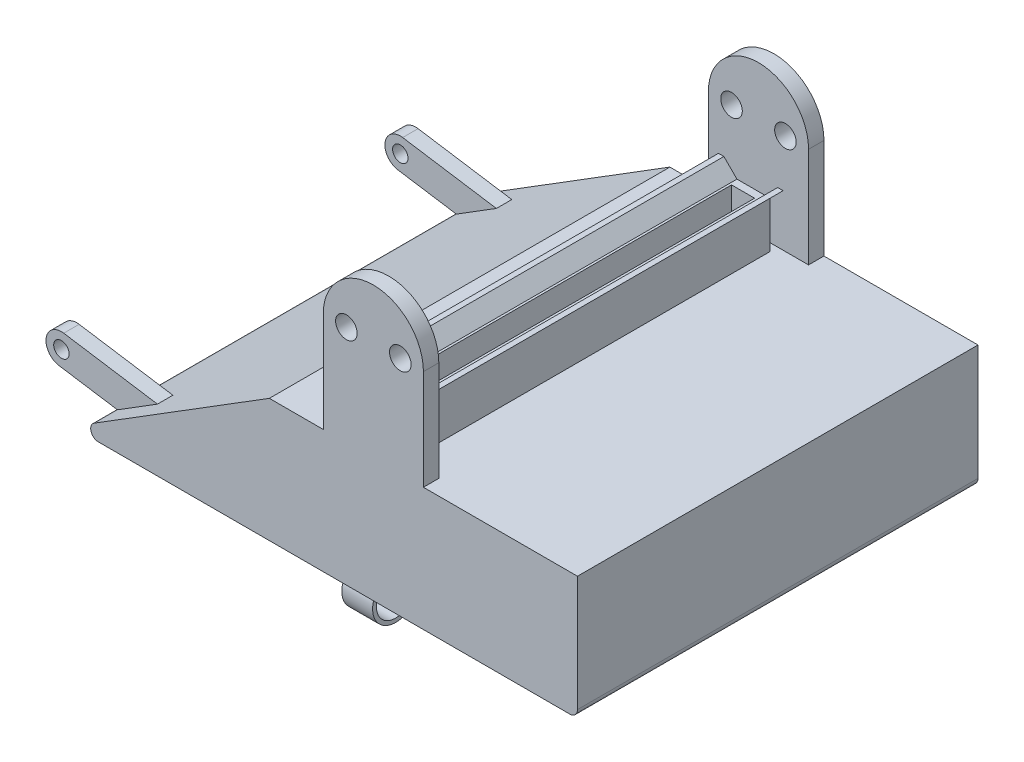
from build123d import *

# Parameters (mm, degrees)
SKETCH5_W            = 200
SKETCH5_H            = 250
SKETCH5_W_2          = 15
SKETCH5_H_2          = 220
BOSS_EXTRUDE7_DEPTH  = 10
BOSS_EXTRUDE13_DEPTH = 250
BOSS_EXTRUDE14_DEPTH = 5
SKETCH8_W            = 25
SKETCH8_H            = 230
SKETCH8_W_2          = 15
SKETCH8_H_2          = 220
BOSS_EXTRUDE15_DEPTH = 30
BOSS_EXTRUDE16_DEPTH = 230
SKETCH11_R           = 7
BOSS_EXTRUDE17_DEPTH = 10
SKETCH12_R           = 5
BOSS_EXTRUDE18_DEPTH = 10
SKETCH14_R           = 12.5
BOSS_EXTRUDE20_DEPTH = 10
SKETCH18_R           = 12.5
BOSS_EXTRUDE21_DEPTH = 10


with BuildPart() as part:
    # Sketch5 → Boss-Extrude7 (new body)
    with BuildSketch(Plane(origin=(0, -75, 0), x_dir=(1, 0, 0), z_dir=(0, 1, 0))):
        with Locations((50, 0)):
            Rectangle(SKETCH5_W, SKETCH5_H)
        with Locations((17.5, 0)):
            Rectangle(SKETCH5_W_2, SKETCH5_H_2, mode=Mode.SUBTRACT)
    extrude(amount=BOSS_EXTRUDE7_DEPTH)



with BuildPart() as body_2:
    # Sketch6 → Boss-Extrude13 (new body)
    with BuildSketch(Plane.XY.offset(125)):
        with BuildLine():
            Line((150, -75), (150, -140))
            ThreePointArc((150, -140), (148.535533906, -143.535533906), (145, -145))
            Line((145, -145), (-160.984652809, -145))
            ThreePointArc((-160.984652809, -145), (-165.792037256, -141.374428892), (-163.627616041, -135.755621912))
            Line((-163.627616041, -135.755621912), (-50, -65))
            Line((-50, -65), (-50, -74.003631477))
            Line((-50, -74.003631477), (-55, -74.003631477))
            Line((-55, -74.003631477), (-153.561803461, -135.377810956))
            ThreePointArc((-153.561803461, -135.377810956), (-154.644014069, -138.187214446), (-152.240321845, -140))
            Line((-152.240321845, -140), (140, -140))
            ThreePointArc((140, -140), (143.535533906, -138.535533906), (145, -135))
            Line((145, -135), (145, -75))
            Line((145, -75), (150, -75))
        make_face()
    extrude(amount=-BOSS_EXTRUDE13_DEPTH)


with BuildPart() as part_1:
    add(part.part)

    add(body_2.part)  # Boss-Extrude14 merges body 2
    # Sketch7 → Boss-Extrude14 (add)
    with BuildSketch(Plane.XY.offset(125)):
        with BuildLine():
            Line((150, -65), (-50, -65))
            Line((-50, -65), (-163.627616041, -135.755621912))
            ThreePointArc((-163.627616041, -135.755621912), (-165.792037256, -141.374428892), (-160.984652809, -145))
            Line((-160.984652809, -145), (145, -145))
            ThreePointArc((145, -145), (148.535533906, -143.535533906), (150, -140))
            Line((150, -140), (150, -65))
        make_face()
    boss_extrude14 = extrude(amount=BOSS_EXTRUDE14_DEPTH)

    # Mirror1: Boss-Extrude14 across plane
    add(boss_extrude14.mirror(Plane.XY))

    # Sketch8 → Boss-Extrude15 (add)
    with BuildSketch(Plane(origin=(0, -65, 0), x_dir=(1, 0, 0), z_dir=(0, 1, 0))):
        with Locations((17.5, 0)):
            Rectangle(SKETCH8_W, SKETCH8_H)
        with Locations((17.5, 0)):
            Rectangle(SKETCH8_W_2, SKETCH8_H_2, mode=Mode.SUBTRACT)
    extrude(amount=BOSS_EXTRUDE15_DEPTH)

    # Sketch9 → Boss-Extrude16 (add)
    with BuildSketch(Plane.XY.offset(115)):
        Polygon((30, -35), (38.485281374, -26.514718626), (34.949747468, -26.514718626), (30, -31.464466094), (26.464466094, -35), align=None)
        Polygon((5, -35), (-3.485281374, -26.514718626), (0.050252532, -26.514718626), (5, -31.464466094), (8.535533906, -35), align=None)
    extrude(amount=-BOSS_EXTRUDE16_DEPTH)

    # Sketch11 → Boss-Extrude17 (add)
    with BuildSketch(Plane.XY.offset(130)):
        with BuildLine():
            Line((-15, -65), (50, -65))
            Line((50, -65), (50, 0))
            ThreePointArc((50, 0), (17.5, 32.5), (-15, 0))
            Line((-15, 0), (-15, -65))
        make_face()
        Circle(SKETCH11_R, mode=Mode.SUBTRACT)
        with Locations((35, 0)):
            Circle(SKETCH11_R, mode=Mode.SUBTRACT)
    boss_extrude17 = extrude(amount=-BOSS_EXTRUDE17_DEPTH)

    # Mirror2: Boss-Extrude17 across plane
    add(boss_extrude17.mirror(Plane.XY))

    # Sketch12 → Boss-Extrude18 (add)
    with BuildSketch(Plane.XY.offset(115)):
        with BuildLine():
            Line((-198.464399722, -110.118606789), (-137.637061185, -119.571370787))
            Line((-137.637061185, -119.571370787), (-163.627616041, -135.755621912))
            Line((-163.627616041, -135.755621912), (-201.531325193, -129.882056626))
            ThreePointArc((-201.531325193, -129.882056626), (-209.881725149, -118.466537228), (-198.464399722, -110.118606789))
        make_face()
        with Locations((-200, -120)):
            Circle(SKETCH12_R, mode=Mode.SUBTRACT)
    boss_extrude18 = extrude(amount=-BOSS_EXTRUDE18_DEPTH)

    # Mirror3: Boss-Extrude18 across plane
    add(boss_extrude18.mirror(Plane.XY))


with BuildPart() as body_2_2:
    # Sketch14 → Boss-Extrude20 (new, symmetric)
    with BuildSketch(Plane(origin=(-7.992326405, 0, 0), x_dir=(0, 0, -1), z_dir=(1, 0, 0))):
        with BuildLine():
            Line((-110, -145), (-110, -153.819660113))
            ThreePointArc((-110, -153.819660113), (-100, -180), (-90, -153.819660113))
            Line((-90, -153.819660113), (-90, -145))
            Line((-90, -145), (-110, -145))
        make_face()
        with Locations((-100, -165)):
            Circle(SKETCH14_R, mode=Mode.SUBTRACT)
    boss_extrude20 = extrude(amount=BOSS_EXTRUDE20_DEPTH, both=True)


with BuildPart() as part_2:
    add(part_1.part)

    # Mirror11: Boss-Extrude20 across plane
    add(boss_extrude20.mirror(Plane.XY))

    # Sketch18 → Boss-Extrude21 (add, symmetric)
    with BuildSketch(Plane.XY):
        with BuildLine():
            Line((-117.994652809, -145), (-97.994652809, -145))
            Line((-97.994652809, -145), (-97.994652809, -153.819660113))
            ThreePointArc((-97.994652809, -153.819660113), (-107.994652809, -180), (-117.994652809, -153.819660113))
            Line((-117.994652809, -153.819660113), (-117.994652809, -145))
        make_face()
        with Locations((-107.994652809, -165)):
            Circle(SKETCH18_R, mode=Mode.SUBTRACT)
    boss_extrude21 = extrude(amount=BOSS_EXTRUDE21_DEPTH, both=True)

    # Mirror15: Boss-Extrude21 across plane
    add(boss_extrude21.mirror(Plane(origin=(-7.992326405, 0, 0), x_dir=(0, 0, 1), z_dir=(1, 0, 0))))


solid = Compound([body_2_2.part, part_2.part])
